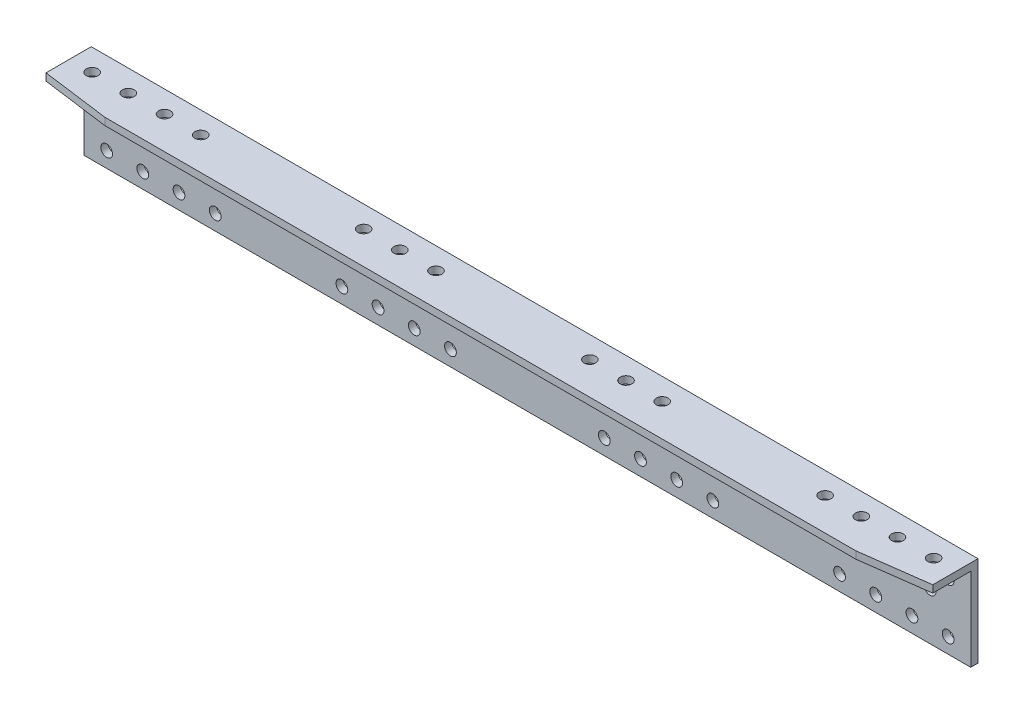
from build123d import *

# Parameters (mm, degrees)
SKETCH_1_W          = 1960
SKETCH_1_H          = 200
SKETCH_1_R          = 13
EXTRUDE_1571_DEPTH  = 16
SKETCH_2_W          = 1960
SKETCH_2_H          = 16
EXTRUDE_1_DEPTH     = 104
SKETCH_3_R          = 13
CUT_EXTRUDE_1_DEPTH = 1008.372820757


with BuildPart() as part:
    # 草图1 → Extrude 1571 (new body)
    with BuildSketch(Plane.XY):
        with Locations((0, 100)):
            Rectangle(SKETCH_1_W, SKETCH_1_H)
        with Locations((930, 146)):
            Circle(SKETCH_1_R, mode=Mode.SUBTRACT)
        with Locations(Location((-890, 106, 0), (0, 0, 180))):
            Circle(SKETCH_1_R, mode=Mode.SUBTRACT)
        with Locations((850, 146)):
            Circle(SKETCH_1_R, mode=Mode.SUBTRACT)
        with Locations((930, 34)):
            Circle(SKETCH_1_R, mode=Mode.SUBTRACT)
        with Locations((850, 34)):
            Circle(SKETCH_1_R, mode=Mode.SUBTRACT)
        with Locations(Location((-810, 106, 0), (0, 0, 180))):
            Circle(SKETCH_1_R, mode=Mode.SUBTRACT)
        with Locations((770, 34)):
            Circle(SKETCH_1_R, mode=Mode.SUBTRACT)
        with Locations((770, 146)):
            Circle(SKETCH_1_R, mode=Mode.SUBTRACT)
        with Locations(Location((-730, 106, 0), (0, 0, 180))):
            Circle(SKETCH_1_R, mode=Mode.SUBTRACT)
        with Locations((690, 146)):
            Circle(SKETCH_1_R, mode=Mode.SUBTRACT)
        with Locations((690, 34)):
            Circle(SKETCH_1_R, mode=Mode.SUBTRACT)
        with Locations(Location((-650, 106, 0), (0, 0, 180))):
            Circle(SKETCH_1_R, mode=Mode.SUBTRACT)
        with Locations(Location((170, 146, 0), (0, 0, 180))):
            Circle(SKETCH_1_R, mode=Mode.SUBTRACT)
        with Locations(Location((170, 34, 0), (0, 0, 180))):
            Circle(SKETCH_1_R, mode=Mode.SUBTRACT)
        with Locations(Location((-410, 146, 0), (0, 0, 180))):
            Circle(SKETCH_1_R, mode=Mode.SUBTRACT)
        with Locations(Location((250, 34, 0), (0, 0, 180))):
            Circle(SKETCH_1_R, mode=Mode.SUBTRACT)
        with Locations(Location((250, 146, 0), (0, 0, 180))):
            Circle(SKETCH_1_R, mode=Mode.SUBTRACT)
        with Locations(Location((-450, 106, 0), (0, 0, 180))):
            Circle(SKETCH_1_R, mode=Mode.SUBTRACT)
        with Locations(Location((330, 34, 0), (0, 0, 180))):
            Circle(SKETCH_1_R, mode=Mode.SUBTRACT)
        with Locations(Location((330, 146, 0), (0, 0, 180))):
            Circle(SKETCH_1_R, mode=Mode.SUBTRACT)
        with Locations(Location((-370, 106, 0), (0, 0, 180))):
            Circle(SKETCH_1_R, mode=Mode.SUBTRACT)
        with Locations(Location((-290, 106, 0), (0, 0, 180))):
            Circle(SKETCH_1_R, mode=Mode.SUBTRACT)
        with Locations(Location((-210, 106, 0), (0, 0, 180))):
            Circle(SKETCH_1_R, mode=Mode.SUBTRACT)
        with Locations((890, 106)):
            Circle(SKETCH_1_R, mode=Mode.SUBTRACT)
        with Locations((810, 106)):
            Circle(SKETCH_1_R, mode=Mode.SUBTRACT)
        with Locations((650, 106)):
            Circle(SKETCH_1_R, mode=Mode.SUBTRACT)
        with Locations((730, 106)):
            Circle(SKETCH_1_R, mode=Mode.SUBTRACT)
        with Locations((-330, 146)):
            Circle(SKETCH_1_R, mode=Mode.SUBTRACT)
        with Locations((-330, 34)):
            Circle(SKETCH_1_R, mode=Mode.SUBTRACT)
        with Locations((410, 146)):
            Circle(SKETCH_1_R, mode=Mode.SUBTRACT)
        with Locations((-250, 146)):
            Circle(SKETCH_1_R, mode=Mode.SUBTRACT)
        with Locations((-250, 34)):
            Circle(SKETCH_1_R, mode=Mode.SUBTRACT)
        with Locations((450, 106)):
            Circle(SKETCH_1_R, mode=Mode.SUBTRACT)
        with Locations((-170, 34)):
            Circle(SKETCH_1_R, mode=Mode.SUBTRACT)
        with Locations((-170, 146)):
            Circle(SKETCH_1_R, mode=Mode.SUBTRACT)
        with Locations((370, 106)):
            Circle(SKETCH_1_R, mode=Mode.SUBTRACT)
        with Locations(Location((-690, 146, 0), (0, 0, 180))):
            Circle(SKETCH_1_R, mode=Mode.SUBTRACT)
        with Locations((290, 106)):
            Circle(SKETCH_1_R, mode=Mode.SUBTRACT)
        with Locations(Location((-770, 146, 0), (0, 0, 180))):
            Circle(SKETCH_1_R, mode=Mode.SUBTRACT)
        with Locations((210, 106)):
            Circle(SKETCH_1_R, mode=Mode.SUBTRACT)
        with Locations(Location((-850, 146, 0), (0, 0, 180))):
            Circle(SKETCH_1_R, mode=Mode.SUBTRACT)
        with Locations((130, 106)):
            Circle(SKETCH_1_R, mode=Mode.SUBTRACT)
        with Locations(Location((-930, 146, 0), (0, 0, 180))):
            Circle(SKETCH_1_R, mode=Mode.SUBTRACT)
        with Locations(Location((-690, 34, 0), (0, 0, 180))):
            Circle(SKETCH_1_R, mode=Mode.SUBTRACT)
        with Locations(Location((-770, 34, 0), (0, 0, 180))):
            Circle(SKETCH_1_R, mode=Mode.SUBTRACT)
        with Locations(Location((-850, 34, 0), (0, 0, 180))):
            Circle(SKETCH_1_R, mode=Mode.SUBTRACT)
        with Locations(Location((-930, 34, 0), (0, 0, 180))):
            Circle(SKETCH_1_R, mode=Mode.SUBTRACT)
        with Locations(Location((-130, 106, 0), (0, 0, 180))):
            Circle(SKETCH_1_R, mode=Mode.SUBTRACT)
        with Locations((410, 34)):
            Circle(SKETCH_1_R, mode=Mode.SUBTRACT)
        with Locations(Location((-410, 34, 0), (0, 0, 180))):
            Circle(SKETCH_1_R, mode=Mode.SUBTRACT)
    extrude(amount=EXTRUDE_1571_DEPTH)

    # 草图2 → 凸台-拉伸1 (add)
    with BuildSketch(Plane.XY.offset(16)):
        with Locations((0, 192)):
            Rectangle(SKETCH_2_W, SKETCH_2_H)
    extrude(amount=EXTRUDE_1_DEPTH)

    # 草图3 → 切除-拉伸1 (cut, through all)
    with BuildSketch(Plane(origin=(0, 200, 0), x_dir=(-1, 0, 0), z_dir=(0, 1, 0))):
        with Locations(Location((-930, 48, 0), (0, 0, 90))):
            Circle(SKETCH_3_R)
        with Locations(Location((-850, 48, 0), (0, 0, 90))):
            Circle(SKETCH_3_R)
        with Locations(Location((-770, 48, 0), (0, 0, 90))):
            Circle(SKETCH_3_R)
        with Locations(Location((-690, 48, 0), (0, 0, 90))):
            Circle(SKETCH_3_R)
        with Locations(Location((-330, 48, 0), (0, 0, 90))):
            Circle(SKETCH_3_R)
        with Locations(Location((-250, 48, 0), (0, 0, 90))):
            Circle(SKETCH_3_R)
        with Locations(Location((-170, 48, 0), (0, 0, 90))):
            Circle(SKETCH_3_R)
        with Locations(Location((170, 48, 0), (0, 0, 90))):
            Circle(SKETCH_3_R)
        with Locations(Location((250, 48, 0), (0, 0, 90))):
            Circle(SKETCH_3_R)
        with Locations(Location((330, 48, 0), (0, 0, 90))):
            Circle(SKETCH_3_R)
        with Locations(Location((930, 48, 0), (0, 0, 90))):
            Circle(SKETCH_3_R)
        with Locations(Location((850, 48, 0), (0, 0, 90))):
            Circle(SKETCH_3_R)
        with Locations(Location((770, 48, 0), (0, 0, 90))):
            Circle(SKETCH_3_R)
        with Locations(Location((690, 48, 0), (0, 0, 90))):
            Circle(SKETCH_3_R)
        Polygon((-980, 100), (-830, 120), (-980, 120), align=None)
        Polygon((980, 100), (830, 120), (980, 120), align=None)
    extrude(amount=-CUT_EXTRUDE_1_DEPTH, mode=Mode.SUBTRACT)


solid = part.part
